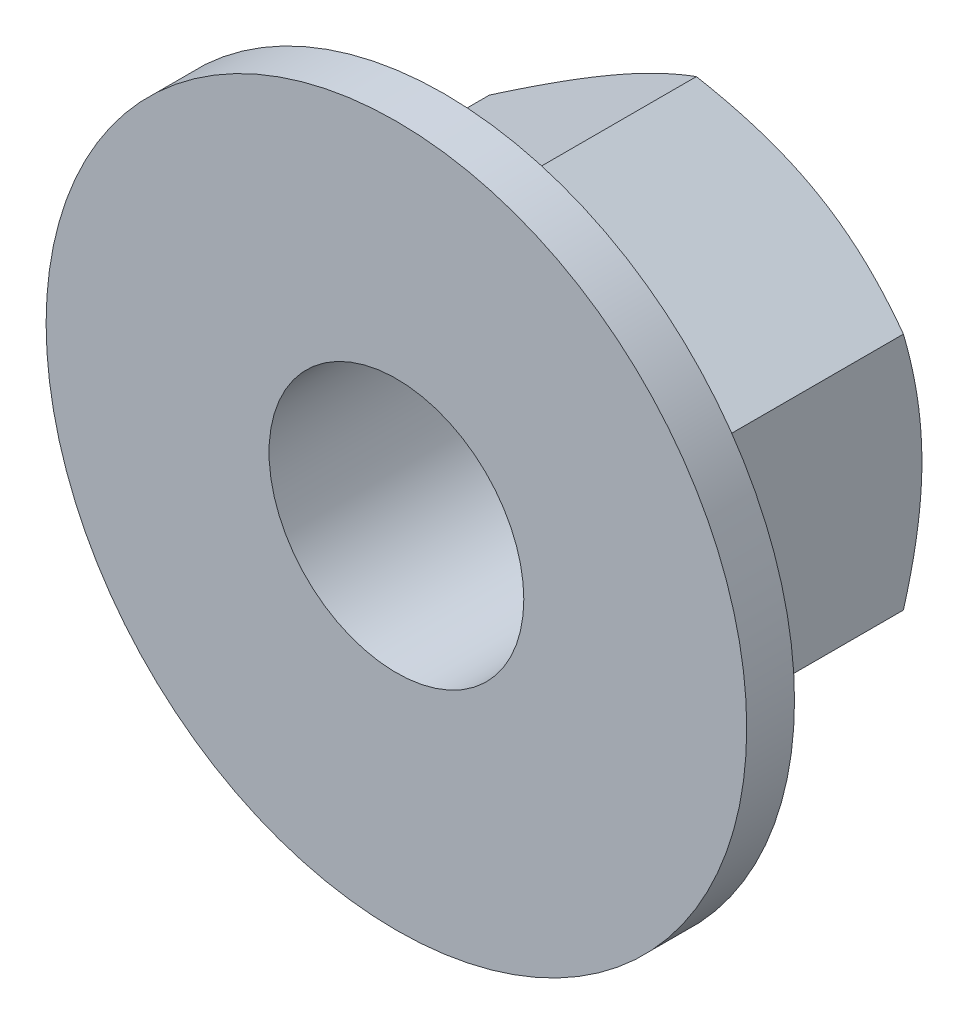
from build123d import *

# Parameters (mm, degrees)
BASE_EXTRUSION_DEPTH    = 10
ESQUISSE3_R             = 4
ENL_V_MAT_EXTRU_1_DEPTH = 15.091959883


with BuildPart() as part:
    # Esquisse1 → Base-Extrusion (new body)
    with BuildSketch(Plane.XY):
        Polygon((6.5, -3.75277675), (6.5, 3.75277675), (0, 7.505553499), (-6.5, 3.75277675), (-6.5, -3.75277675), (0, -7.505553499), align=None)
    extrude(amount=-BASE_EXTRUSION_DEPTH)

    # Esquisse2 → Enlèvement de matière-Révolution1 (revolve, cut)
    with BuildSketch(Plane(origin=(0, 0, 0), x_dir=(1, 0, 0), z_dir=(0, 1, 0))):
        Polygon((-6.5, 10), (-23.820508076, 10), (-23.820508076, 0), align=None)
    revolve(axis=Axis((0, 0, -10), (0, 0, 1)), mode=Mode.SUBTRACT)

    # Esquisse3 → Enlèv. mat.-Extru.1 (cut, through all)
    with BuildSketch(Plane.XY):
        Circle(ESQUISSE3_R)
    extrude(amount=-ENL_V_MAT_EXTRU_1_DEPTH, mode=Mode.SUBTRACT)

    # Esquisse4 → Boss.-Révol.1 (revolve)
    with BuildSketch(Plane(origin=(0, 0, 0), x_dir=(1, 0, 0), z_dir=(0, 1, 0))):
        Polygon((-6.5, 0), (-11, 0), (-11, 1.5), (-8, 3), (-8, 3.5), (-6.5, 3.5), align=None)
    revolve(axis=Axis((0, 0, 0), (0, 0, -1)))


solid = part.part
